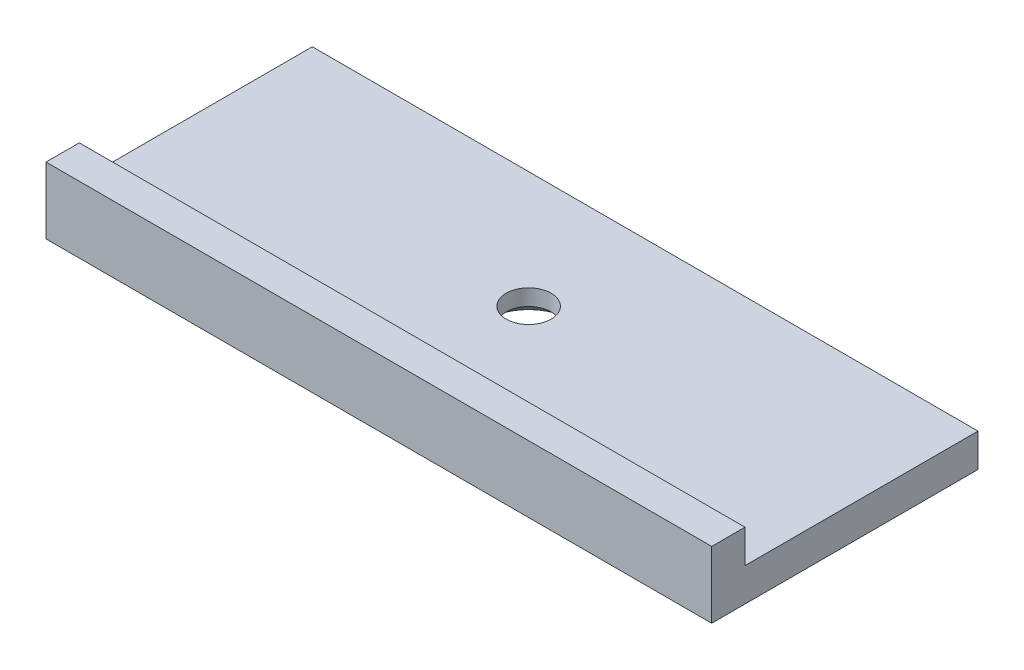
from build123d import *

# Parameters (mm, degrees)
SKETCH1_W                                           = 100
SKETCH1_H                                           = 35
BOSS_EXTRUDE1_DEPTH                                 = 5
SKETCH2_W                                           = 100
SKETCH2_H                                           = 5
BOSS_EXTRUDE2_DEPTH                                 = 10
CSK_FOR_1_4_FLAT_HEAD_MACHINE_SCREW_100_D           = 6.7564
CSK_FOR_1_4_FLAT_HEAD_MACHINE_SCREW_100_CSINK_D     = 12.8778
CSK_FOR_1_4_FLAT_HEAD_MACHINE_SCREW_100_CSINK_ANGLE = 100


with BuildPart() as part:
    # Sketch1 → Boss-Extrude1 (new body)
    with BuildSketch(Plane(origin=(0, 0, 0), x_dir=(1, 0, 0), z_dir=(0, 1, 0))):
        Rectangle(SKETCH1_W, SKETCH1_H)
    extrude(amount=BOSS_EXTRUDE1_DEPTH)

    # Sketch2 → Boss-Extrude2 (add)
    with BuildSketch(Plane(origin=(0, 0, 0), x_dir=(1, 0, 0), z_dir=(0, 1, 0))):
        with Locations((0, -20)):
            Rectangle(SKETCH2_W, SKETCH2_H)
    extrude(amount=BOSS_EXTRUDE2_DEPTH)

    # CSK for 1/4 Flat Head Machine Screw (100)1 (through all)
    with Locations(Plane(origin=(0, 0, 0), x_dir=(-1, 0, 0), z_dir=(0, -1, 0))):
        with Locations((0, 0)):
            CounterSinkHole(CSK_FOR_1_4_FLAT_HEAD_MACHINE_SCREW_100_D / 2, CSK_FOR_1_4_FLAT_HEAD_MACHINE_SCREW_100_CSINK_D / 2, counter_sink_angle=CSK_FOR_1_4_FLAT_HEAD_MACHINE_SCREW_100_CSINK_ANGLE)


solid = part.part
